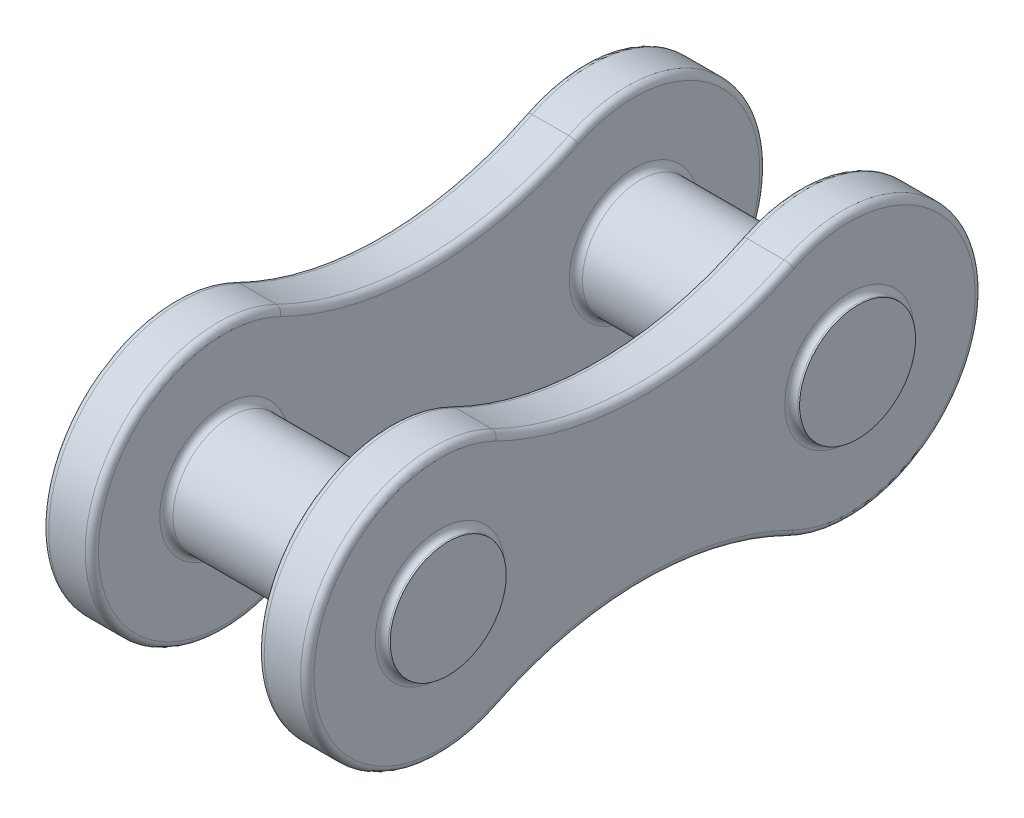
from build123d import *

# Parameters (mm, degrees)
SALIENTE_EXTRUIR1_START = 2.5
CROQUIS1_R              = 1.75
SALIENTE_EXTRUIR1_DEPTH = 1.5
SALIENTE_EXTRUIR2_START = -2.5
CROQUIS2_R              = 1.75
SALIENTE_EXTRUIR2_DEPTH = 1.5
CROQUIS3_R              = 1.75
SALIENTE_EXTRUIR3_DEPTH = 4.25
REDONDEO1_R             = 0.2


with BuildPart() as part:
    # Croquis1 → Saliente-Extruir1 (new body)
    with BuildSketch(Plane(origin=(0, 0, 0), x_dir=(0, 0, -1), z_dir=(1, 0, 0)).offset(SALIENTE_EXTRUIR1_START)):
        with BuildLine():
            ThreePointArc((-4.410714286, 3.589888009), (-10.175, 0), (-4.410714286, -3.589888009))
            ThreePointArc((-4.410714286, -3.589888009), (0, -2.564608032), (4.410714286, -3.589888009))
            ThreePointArc((4.410714286, -3.589888009), (10.175, 0), (4.410714286, 3.589888009))
            ThreePointArc((4.410714286, 3.589888009), (0, 2.564608032), (-4.410714286, 3.589888009))
        make_face()
        with Locations((-6.175, 0)):
            Circle(CROQUIS1_R, mode=Mode.SUBTRACT)
        with Locations(Location((6.175, 0, 0), (0, 0, 180))):
            Circle(CROQUIS1_R, mode=Mode.SUBTRACT)
    extrude(amount=SALIENTE_EXTRUIR1_DEPTH)



with BuildPart() as body_2:
    # Croquis2 → Saliente-Extruir2 (new body)
    with BuildSketch(Plane(origin=(0, 0, 0), x_dir=(0, 0, -1), z_dir=(1, 0, 0)).offset(SALIENTE_EXTRUIR2_START)):
        with BuildLine():
            ThreePointArc((-4.410714286, 3.589888009), (0, 2.564608032), (4.410714286, 3.589888009))
            ThreePointArc((4.410714286, 3.589888009), (10.175, 0), (4.410714286, -3.589888009))
            ThreePointArc((4.410714286, -3.589888009), (0, -2.564608032), (-4.410714286, -3.589888009))
            ThreePointArc((-4.410714286, -3.589888009), (-10.175, 0), (-4.410714286, 3.589888009))
        make_face()
        with Locations(Location((6.175, 0, 0), (0, 0, 180))):
            Circle(CROQUIS2_R, mode=Mode.SUBTRACT)
        with Locations((-6.175, 0)):
            Circle(CROQUIS2_R, mode=Mode.SUBTRACT)
    extrude(amount=-SALIENTE_EXTRUIR2_DEPTH)


with BuildPart() as part_1:
    add(part.part)

    add(body_2.part)  # Saliente-Extruir3 merges body 2
    # Croquis3 → Saliente-Extruir3 (add, symmetric)
    with BuildSketch(Plane(origin=(0, 0, 0), x_dir=(0, 0, -1), z_dir=(1, 0, 0))):
        with Locations((6.175, 0)):
            Circle(CROQUIS3_R)
        with Locations((-6.175, 0)):
            Circle(CROQUIS3_R)
    extrude(amount=SALIENTE_EXTRUIR3_DEPTH, both=True)

    # Redondeo1
    redondeo1_edges = [part_1.edges().sort_by_distance(p)[0] for p in [
        (4, 0, 7.925),
        (4, -2.564608032, 0),
        (4, 0, -4.425),
        (4, 0, -10.175),
        (2.5, 0, -4.425),
        (-4, 0, -4.425),
        (-4, 0, 10.175),
        (-4, 2.564608032, 0),
        (-4, 0, -10.175),
        (-4, -2.564608032, 0),
        (-2.5, 0, 10.175),
        (-2.5, -2.564608032, 0),
        (-2.5, 0, -10.175),
        (-2.5, 2.564608032, 0),
        (-2.5, 0, -4.425),
        (-2.5, 0, 7.925),
        (2.5, 0, 7.925),
        (-4, 0, 7.925),
        (4, 2.564608032, 0),
        (2.5, 0, -10.175),
        (2.5, -2.564608032, 0),
        (2.5, 0, 10.175),
        (2.5, 2.564608032, 0),
        (4, 0, 10.175),
    ]]
    fillet(redondeo1_edges, radius=REDONDEO1_R)


solid = part_1.part
